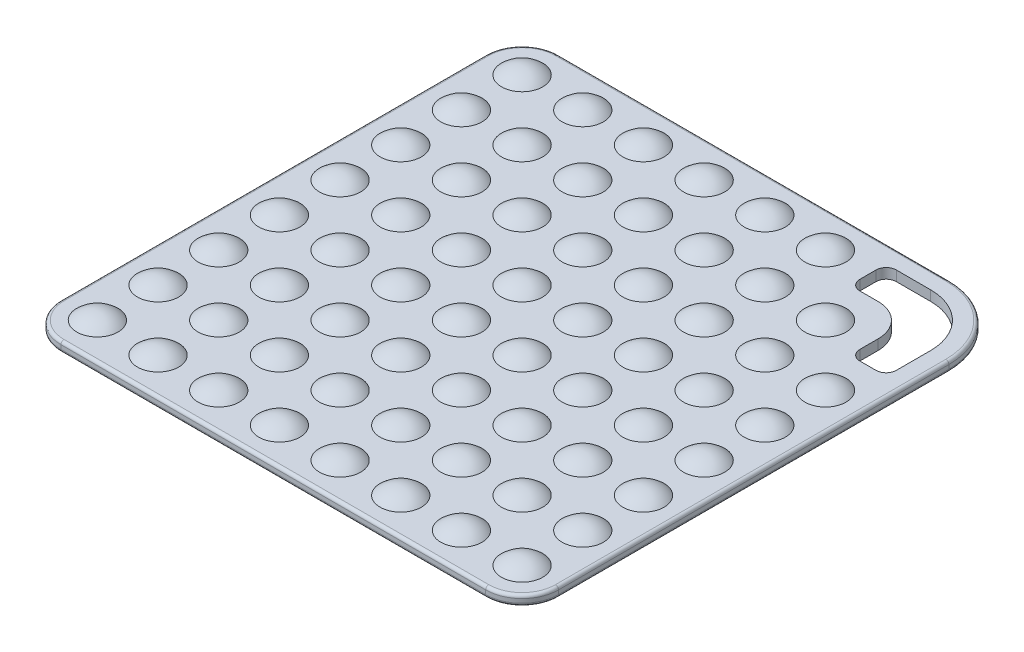
from build123d import *

# Parameters (mm, degrees)
BOSS_EXTRUDE1_DEPTH  = 5
FILLET1_R            = 1.5
FILLET2_R            = 1.5
LPATTERN4_COUNT      = 8
LPATTERN4_PITCH      = 30
LPATTERN4_COUNT_DIR2 = 8
LPATTERN4_PITCH_DIR2 = 30
CUT_EXTRUDE1_DEPTH   = 5


with BuildPart() as part:
    # Sketch1 → Boss-Extrude1 (new body)
    with BuildSketch(Plane(origin=(0, 0, 0), x_dir=(1, 0, 0), z_dir=(0, 1, 0))):
        with BuildLine():
            Line((-105, 123), (88, 123))
            ThreePointArc((88, 123), (112.748737342, 112.748737342), (123, 88))
            Line((123, 88), (123, -105))
            ThreePointArc((123, -105), (117.727922061, -117.727922061), (105, -123))
            Line((105, -123), (-105, -123))
            ThreePointArc((-105, -123), (-117.727922061, -117.727922061), (-123, -105))
            Line((-123, -105), (-123, 105))
            ThreePointArc((-123, 105), (-117.727922061, 117.727922061), (-105, 123))
        make_face()
    extrude(amount=BOSS_EXTRUDE1_DEPTH)

    # Fillet1
    fillet1_edges = [part.edges().sort_by_distance(p)[0] for p in [
        (117.727922061, 5, 117.727922061),
        (123, 5, 8.5),
        (112.748737342, 5, -112.748737342),
        (-8.5, 5, -123),
        (-117.727922061, 5, -117.727922061),
        (-123, 5, 0),
        (-117.727922061, 5, 117.727922061),
        (0, 5, 123),
    ]]
    fillet(fillet1_edges, radius=FILLET1_R)

    # Fillet2
    fillet2_edges = [part.edges().sort_by_distance(p)[0] for p in [
        (123, 0, 8.5),
        (117.727922061, 0, 117.727922061),
        (0, 0, 123),
        (-117.727922061, 0, 117.727922061),
        (-123, 0, 0),
        (-117.727922061, 0, -117.727922061),
        (-8.5, 0, -123),
        (112.748737342, 0, -112.748737342),
    ]]
    fillet(fillet2_edges, radius=FILLET2_R)

    # Sketch4 → Revolve1 (revolve)
    with BuildSketch(Plane(origin=(105, 0, 0), x_dir=(0, 0, -1), z_dir=(1, 0, 0)), mode=Mode.PRIVATE) as revolve1_sk:
        with BuildLine():
            Line((-105, 9), (-105, 5))
            Line((-105, 5), (-115.198039027, 5))
            ThreePointArc((-115.198039027, 5), (-110.477225575, 7.964240044), (-105, 9))
        make_face()
    revolve1 = revolve(revolve1_sk.sketch.rotate(Axis((105, 5, 105), (0, 1, 0)), 180), axis=Axis((105, 5, 105), (0, 1, 0)))

    # LPattern4: Revolve1 8 × 8, 3 skipped
    with Locations(*[(-j * LPATTERN4_PITCH_DIR2, 0, -i * LPATTERN4_PITCH) for i in range(LPATTERN4_COUNT) for j in range(LPATTERN4_COUNT_DIR2) if (i, j) not in ((0, 0), (6, 0), (7, 0), (7, 1))]):
        add(revolve1)

    # Sketch7 → Cut-Extrude1 (cut)
    with BuildSketch(Plane(origin=(0, 5, 0), x_dir=(1, 0, 0), z_dir=(0, 1, 0))):
        with BuildLine():
            Line((66, 109), (66, 101))
            ThreePointArc((66, 101), (67.464466094, 97.464466094), (71, 96))
            Line((71, 96), (80, 96))
            ThreePointArc((80, 96), (91.313708499, 91.313708499), (96, 80))
            Line((96, 80), (96, 71))
            ThreePointArc((96, 71), (97.464466094, 67.464466094), (101, 66))
            Line((101, 66), (109, 66))
            ThreePointArc((109, 66), (112.535533906, 67.464466094), (114, 71))
            Line((114, 71), (114, 88))
            ThreePointArc((114, 88), (106.384776311, 106.384776311), (88, 114))
            Line((88, 114), (71, 114))
            ThreePointArc((71, 114), (67.464466094, 112.535533906), (66, 109))
        make_face()
    extrude(amount=-CUT_EXTRUDE1_DEPTH, mode=Mode.SUBTRACT)


solid = part.part
